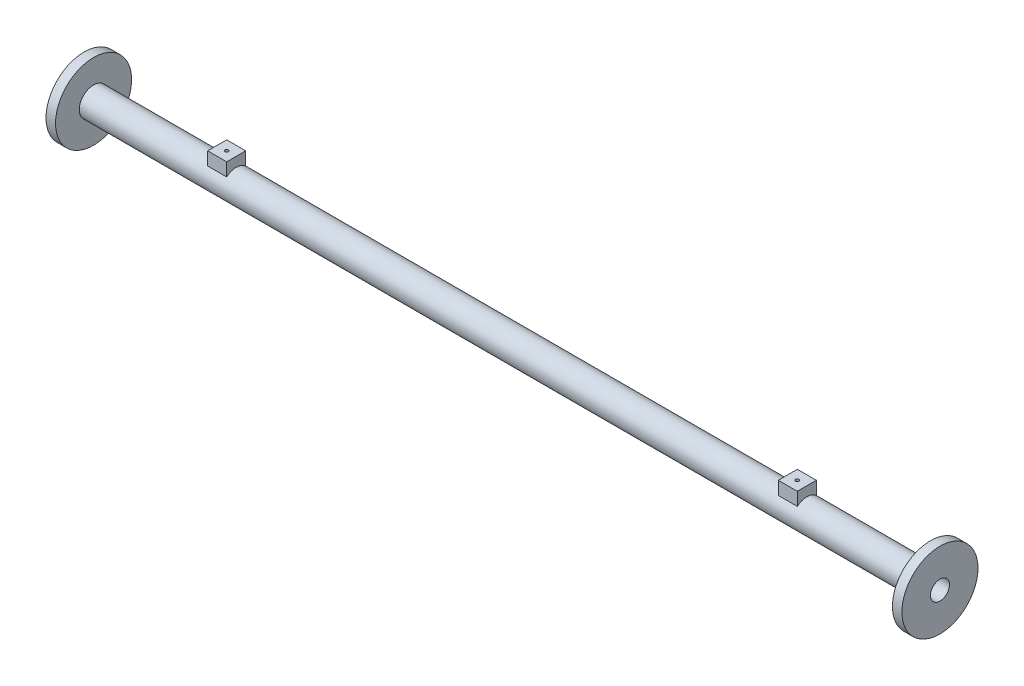
from build123d import *

# Parameters (mm, degrees)
SKETCH1_R                = 19.05
SKETCH1_R_2              = 12.7
BOSS_EXTRUDE1_DEPTH      = 571.5
BOSS_EXTRUDE2_START      = -12.7
SKETCH2_R                = 50.8
SKETCH2_R_2              = 12.7
BOSS_EXTRUDE2_DEPTH      = 12.7
SKETCH3_R                = 50.8
SKETCH3_R_2              = 12.7
BOSS_EXTRUDE3_DEPTH      = 12.7
BOSS_EXTRUDE4_REACH      = 609.748
BOSS_EXTRUDE4_END_RADIUS = 19.05
BOSS_EXTRUDE4_START      = 31.75
SKETCH4_W                = 25.4
SKETCH4_H                = 25.4
SKETCH4_R                = 2.286


with BuildPart() as part:
    # Sketch1 → Boss-Extrude1 (new, symmetric)
    with BuildSketch(Plane(origin=(0, 0, 0), x_dir=(0, 0, -1), z_dir=(1, 0, 0))):
        Circle(SKETCH1_R)
        Circle(SKETCH1_R_2, mode=Mode.SUBTRACT)
    extrude(amount=BOSS_EXTRUDE1_DEPTH, both=True)

    # Sketch2 → Boss-Extrude2 (add)
    with BuildSketch(Plane(origin=(571.5, 0, 0), x_dir=(0, 0, -1), z_dir=(1, 0, 0)).offset(BOSS_EXTRUDE2_START)):
        Circle(SKETCH2_R)
        Circle(SKETCH2_R_2, mode=Mode.SUBTRACT)
    extrude(amount=BOSS_EXTRUDE2_DEPTH)

    # Sketch3 → Boss-Extrude3 (add)
    with BuildSketch(Plane.ZY.offset(571.5)):
        with Locations(Location((0, 0, 0), (0, 0, 180))):
            Circle(SKETCH3_R)
        with Locations(Location((0, 0, 0), (0, 0, 180))):
            Circle(SKETCH3_R_2, mode=Mode.SUBTRACT)
    extrude(amount=-BOSS_EXTRUDE3_DEPTH)

    # Boss-Extrude4: up to this cylinder (the profile starts outside it)
    boss_extrude4_end = Plane(origin=(-6.170395, 0, 0), z_dir=(-1, 0, 0)) * Cylinder(BOSS_EXTRUDE4_END_RADIUS, 2008.25521, mode=Mode.PRIVATE)
    # Sketch4 → Boss-Extrude4 (add, up to the surface)
    with BuildSketch(Plane(origin=(0, 0, 0), x_dir=(1, 0, 0), z_dir=(0, 1, 0)).offset(BOSS_EXTRUDE4_START), mode=Mode.PRIVATE) as boss_extrude4_sk1:
        with Locations((-381, 0)):
            Rectangle(SKETCH4_W, SKETCH4_H)
        with Locations(Location((-381, 0, 0), (0, 0, 270))):
            Circle(SKETCH4_R, mode=Mode.SUBTRACT)
    boss_extrude4_tool1 = extrude(boss_extrude4_sk1.sketch, amount=-BOSS_EXTRUDE4_REACH, mode=Mode.PRIVATE) - boss_extrude4_end
    add(boss_extrude4_tool1.solids().sort_by_distance((-381, 31.75, 12.34079))[0])
    # Sketch4 → Boss-Extrude4 (add, up to the surface)
    with BuildSketch(Plane(origin=(0, 0, 0), x_dir=(1, 0, 0), z_dir=(0, 1, 0)).offset(BOSS_EXTRUDE4_START), mode=Mode.PRIVATE) as boss_extrude4_sk2:
        with Locations((381, 0)):
            Rectangle(SKETCH4_W, SKETCH4_H)
        with Locations(Location((381, 0, 0), (0, 0, 270))):
            Circle(SKETCH4_R, mode=Mode.SUBTRACT)
    boss_extrude4_tool2 = extrude(boss_extrude4_sk2.sketch, amount=-BOSS_EXTRUDE4_REACH, mode=Mode.PRIVATE) - boss_extrude4_end
    add(boss_extrude4_tool2.solids().sort_by_distance((368.65921, 31.75, 0))[0])


solid = part.part
